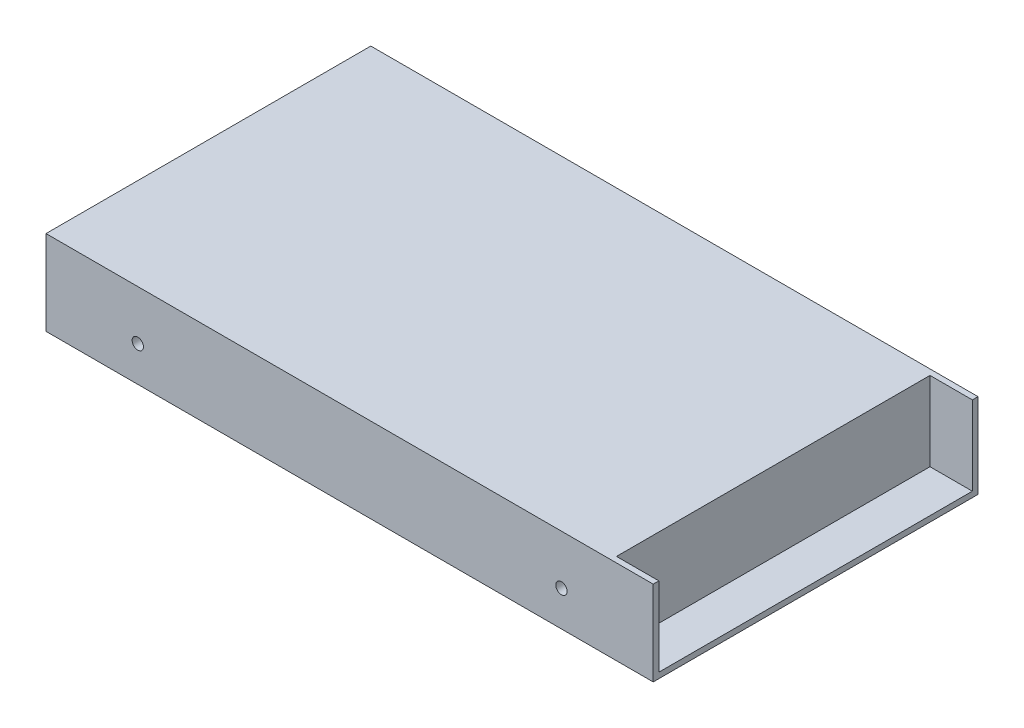
from build123d import *

# Parameters (mm, degrees)
SKETCH1_W           = 215
SKETCH1_H           = 115
BOSS_EXTRUDE1_DEPTH = 30
SKETCH2_W           = 15
SKETCH2_H           = 111
CUT_EXTRUDE1_DEPTH  = 28
SKETCH3_R           = 2
CUT_EXTRUDE2_DEPTH  = 5
SKETCH4_R           = 2
CUT_EXTRUDE3_DEPTH  = 3
CUT_EXTRUDE4_START  = -5
SKETCH5_R           = 2
CUT_EXTRUDE4_DEPTH  = 5


with BuildPart() as part:
    # Sketch1 → Boss-Extrude1 (new body)
    with BuildSketch(Plane(origin=(0, 0, 0), x_dir=(1, 0, 0), z_dir=(0, 1, 0))):
        Rectangle(SKETCH1_W, SKETCH1_H)
    extrude(amount=BOSS_EXTRUDE1_DEPTH)

    # Sketch2 → Cut-Extrude1 (cut)
    with BuildSketch(Plane(origin=(0, 30, 0), x_dir=(1, 0, 0), z_dir=(0, 1, 0))):
        with Locations((100, 0)):
            Rectangle(SKETCH2_W, SKETCH2_H)
    extrude(amount=-CUT_EXTRUDE1_DEPTH, mode=Mode.SUBTRACT)

    # Sketch3 → Cut-Extrude2 (cut)
    with BuildSketch(Plane.XY.offset(57.5)):
        with Locations((75, 12.5)):
            Circle(SKETCH3_R)
        with Locations((-75, 12.5)):
            Circle(SKETCH3_R)
    extrude(amount=-CUT_EXTRUDE2_DEPTH, mode=Mode.SUBTRACT)

    # Sketch4 → Cut-Extrude3 (cut)
    with BuildSketch(Plane.XZ):
        with Locations(Location((75, -25, 0), (0, 0, 270))):
            Circle(SKETCH4_R)
        with Locations(Location((-75, -25, 0), (0, 0, 270))):
            Circle(SKETCH4_R)
        with Locations(Location((-75, 25, 0), (0, 0, 270))):
            Circle(SKETCH4_R)
        with Locations(Location((75, 25, 0), (0, 0, 270))):
            Circle(SKETCH4_R)
    extrude(amount=-CUT_EXTRUDE3_DEPTH, mode=Mode.SUBTRACT)

    # Sketch5 → Cut-Extrude4 (cut)
    with BuildSketch(Plane(origin=(0, 0, -57.5), x_dir=(-1, 0, 0), z_dir=(0, 0, -1)).offset(CUT_EXTRUDE4_START)):
        with Locations(Location((-75, 12.5, 0), (0, 0, 180))):
            Circle(SKETCH5_R)
        with Locations(Location((75, 12.5, 0), (0, 0, 180))):
            Circle(SKETCH5_R)
    extrude(amount=CUT_EXTRUDE4_DEPTH, mode=Mode.SUBTRACT)


solid = part.part
